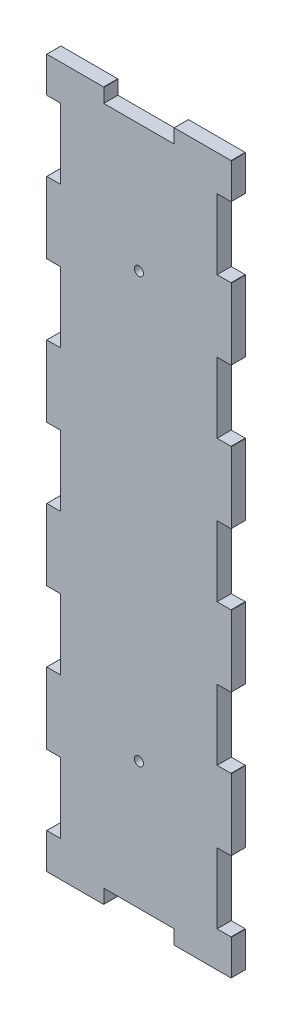
from build123d import *

# Parameters (mm, degrees)
BOSS_EXTRUDE1_DEPTH = 5
SKETCH1_R           = 1.6
CUT_EXTRUDE2_DEPTH  = 130.248833264


with BuildPart() as part:
    # Model → Boss-Extrude1 (new body)
    with BuildSketch(Plane.XY):
        Polygon((-12.44, -124.95), (-12.43, -124.94), (-12.42, -124.92), (-12.41, -124.91), (-12.4, -124.89), (-12.4, -119.97), (12.4, -119.97), (12.4, -124.89), (12.42, -124.93), (12.43, -124.94), (12.45, -124.95), (12.46, -124.96), (12.48, -124.97), (32.52, -124.97), (32.56, -124.95), (32.57, -124.94), (32.58, -124.92), (32.59, -124.91), (32.6, -124.89), (32.6, -112.48), (32.58, -112.44), (32.57, -112.43), (32.55, -112.42), (32.54, -112.41), (32.52, -112.4), (27.6, -112.4), (27.6, -87.6), (32.52, -87.6), (32.56, -87.58), (32.57, -87.57), (32.58, -87.55), (32.59, -87.54), (32.6, -87.52), (32.6, -62.48), (32.58, -62.44), (32.57, -62.43), (32.55, -62.42), (32.54, -62.41), (32.52, -62.4), (27.6, -62.4), (27.6, -37.6), (32.52, -37.6), (32.56, -37.58), (32.57, -37.57), (32.58, -37.55), (32.59, -37.54), (32.6, -37.52), (32.6, -12.48), (32.58, -12.44), (32.57, -12.43), (32.55, -12.42), (32.54, -12.41), (32.52, -12.4), (27.6, -12.4), (27.6, 12.4), (32.52, 12.4), (32.56, 12.42), (32.57, 12.43), (32.58, 12.45), (32.59, 12.46), (32.6, 12.48), (32.6, 37.52), (32.58, 37.56), (32.57, 37.57), (32.55, 37.58), (32.54, 37.59), (32.52, 37.6), (27.6, 37.6), (27.6, 62.4), (32.52, 62.4), (32.56, 62.42), (32.57, 62.43), (32.58, 62.45), (32.59, 62.46), (32.6, 62.48), (32.6, 87.52), (32.58, 87.56), (32.57, 87.57), (32.55, 87.58), (32.54, 87.59), (32.52, 87.6), (27.6, 87.6), (27.6, 112.4), (32.52, 112.4), (32.56, 112.42), (32.57, 112.43), (32.58, 112.45), (32.59, 112.46), (32.6, 112.48), (32.6, 124.89), (32.58, 124.93), (32.57, 124.94), (32.55, 124.95), (32.54, 124.96), (32.52, 124.97), (12.48, 124.97), (12.44, 124.95), (12.43, 124.94), (12.42, 124.92), (12.41, 124.91), (12.4, 124.89), (12.4, 119.97), (-12.4, 119.97), (-12.4, 124.89), (-12.42, 124.93), (-12.43, 124.94), (-12.45, 124.95), (-12.46, 124.96), (-12.48, 124.97), (-32.52, 124.97), (-32.56, 124.95), (-32.57, 124.94), (-32.58, 124.92), (-32.59, 124.91), (-32.6, 124.89), (-32.6, 112.48), (-32.58, 112.44), (-32.57, 112.43), (-32.55, 112.42), (-32.54, 112.41), (-32.52, 112.4), (-27.6, 112.4), (-27.6, 87.6), (-32.52, 87.6), (-32.56, 87.58), (-32.57, 87.57), (-32.58, 87.55), (-32.59, 87.54), (-32.6, 87.52), (-32.6, 62.48), (-32.58, 62.44), (-32.57, 62.43), (-32.55, 62.42), (-32.54, 62.41), (-32.52, 62.4), (-27.6, 62.4), (-27.6, 37.6), (-32.52, 37.6), (-32.56, 37.58), (-32.57, 37.57), (-32.58, 37.55), (-32.59, 37.54), (-32.6, 37.52), (-32.6, 12.48), (-32.58, 12.44), (-32.57, 12.43), (-32.55, 12.42), (-32.54, 12.41), (-32.52, 12.4), (-27.6, 12.4), (-27.6, -12.4), (-32.52, -12.4), (-32.56, -12.42), (-32.57, -12.43), (-32.58, -12.45), (-32.59, -12.46), (-32.6, -12.48), (-32.6, -37.52), (-32.58, -37.56), (-32.57, -37.57), (-32.55, -37.58), (-32.54, -37.59), (-32.52, -37.6), (-27.6, -37.6), (-27.6, -62.4), (-32.52, -62.4), (-32.56, -62.42), (-32.57, -62.43), (-32.58, -62.45), (-32.59, -62.46), (-32.6, -62.48), (-32.6, -87.52), (-32.58, -87.56), (-32.57, -87.57), (-32.55, -87.58), (-32.54, -87.59), (-32.52, -87.6), (-27.6, -87.6), (-27.6, -112.4), (-32.52, -112.4), (-32.56, -112.42), (-32.57, -112.43), (-32.58, -112.45), (-32.59, -112.46), (-32.6, -112.48), (-32.6, -124.89), (-32.58, -124.93), (-32.57, -124.94), (-32.55, -124.95), (-32.54, -124.96), (-32.52, -124.97), (-12.48, -124.97), align=None)
    extrude(amount=BOSS_EXTRUDE1_DEPTH)

    # Sketch1 → Cut-Extrude2 (cut, through all)
    with BuildSketch(Plane.XY.offset(5)):
        with Locations((0, 74.935)):
            Circle(SKETCH1_R)
        with Locations(Location((0, -74.935, 0), (0, 0, 180))):
            Circle(SKETCH1_R)
    extrude(amount=-CUT_EXTRUDE2_DEPTH, mode=Mode.SUBTRACT)


solid = part.part
